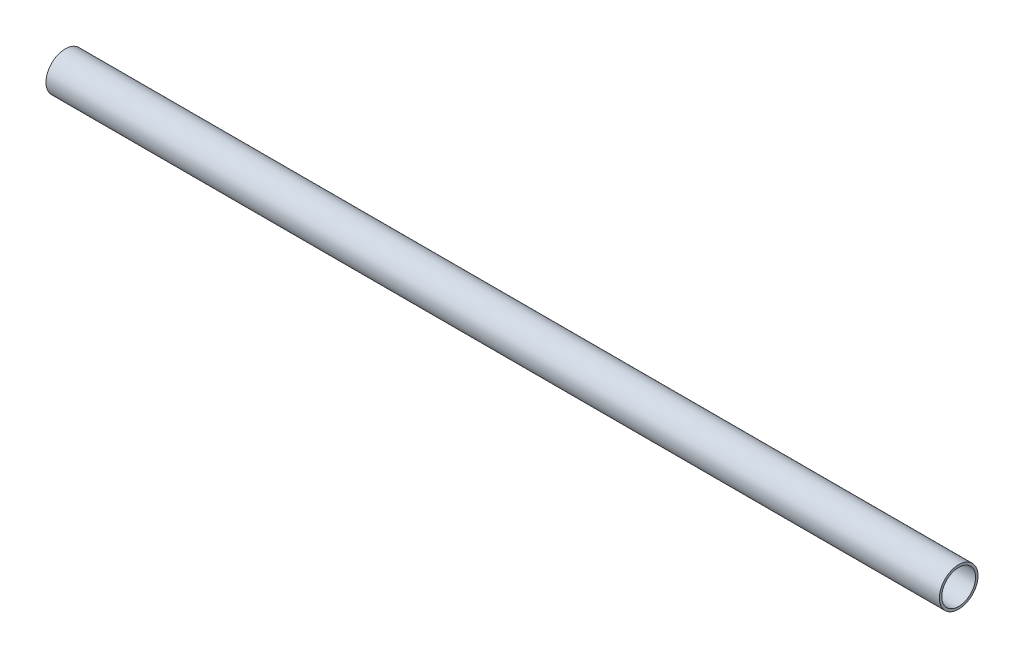
from build123d import *

# Parameters (mm, degrees)
SKETCH_1_R      = 8
SKETCH_1_R_2    = 7
EXTRUDE_1_DEPTH = 185


with BuildPart() as part:
    # 草图1 → 凸台-拉伸1 (new, symmetric)
    with BuildSketch(Plane(origin=(0, 0, 0), x_dir=(0, 0, -1), z_dir=(1, 0, 0))):
        Circle(SKETCH_1_R)
        Circle(SKETCH_1_R_2, mode=Mode.SUBTRACT)
    extrude(amount=EXTRUDE_1_DEPTH, both=True)


solid = part.part
